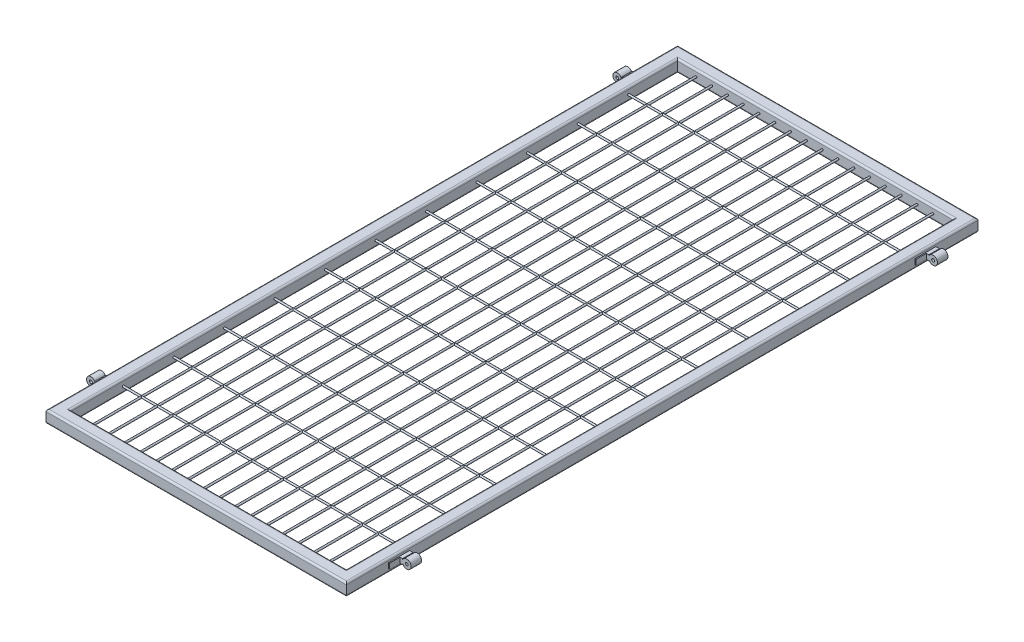
from build123d import *

# Parameters (mm, degrees)
SKETCH_1_W               = 856
SKETCH_1_H               = 1800
SKETCH_1_W_2             = 786
SKETCH_1_H_2             = 1730
EXTRUDE_1_DEPTH          = 35
EXTRUDE_2_DEPTH          = 7.5
SKETCH_3_R               = 12.5
EXTRUDE_3_DEPTH          = 30
SKETCH_4_R               = 4
CUT_EXTRUDE_1_DEPTH      = 30
PATTERN_LINEAR_1_COUNT   = 2
PATTERN_LINEAR_1_PITCH   = 1500
FILLET_1_R               = 5
MIRROR_1_COPY_1_DEPTH    = 7.5
MIRROR_1_COPY_2_SKETCH_R = 12.5
MIRROR_1_COPY_2_DEPTH    = 30
MIRROR_1_COPY_3_SKETCH_R = 4
MIRROR_1_COPY_3_DEPTH    = 30
SKETCH_5_R               = 2.5
EXTRUDE_4_DEPTH          = 786
PATTERN_LINEAR_2_COUNT   = 11
PATTERN_LINEAR_2_PITCH   = 144
EXTRUDE_5_REACH          = 1826.926
SKETCH_6_R               = 2.5
PATTERN_LINEAR_3_COUNT   = 16
PATTERN_LINEAR_3_PITCH   = 45


with BuildPart() as part:
    # 草图1 → 凸台-拉伸1 (new body)
    with BuildSketch(Plane(origin=(0, 0, 0), x_dir=(1, 0, 0), z_dir=(0, 1, 0))):
        Rectangle(SKETCH_1_W, SKETCH_1_H)
        Rectangle(SKETCH_1_W_2, SKETCH_1_H_2, mode=Mode.SUBTRACT)
    extrude(amount=EXTRUDE_1_DEPTH)

    # 草图2 → 凸台-拉伸2 (add, symmetric)
    with BuildSketch(Plane(origin=(0, 17.5, 0), x_dir=(1, 0, 0), z_dir=(0, 1, 0))):
        Polygon((-428, 780), (-428, 720), (-431, 720), (-431, 750), (-438, 750), (-438, 780), align=None)
    extrude_2 = extrude(amount=EXTRUDE_2_DEPTH, both=True)

    # 草图3 → 凸台-拉伸3 (add)
    with BuildSketch(Plane(origin=(0, 0, -780), x_dir=(-1, 0, 0), z_dir=(0, 0, -1))):
        with Locations((450, 17.5)):
            Circle(SKETCH_3_R)
    extrude_3 = extrude(amount=-EXTRUDE_3_DEPTH)

    # 草图4 → 切除-拉伸1 (cut)
    with BuildSketch(Plane.XY.offset(-750)):
        with Locations((-450, 17.5)):
            Circle(SKETCH_4_R)
    cut_extrude_1 = extrude(amount=-CUT_EXTRUDE_1_DEPTH, mode=Mode.SUBTRACT)

    # 阵列(线性)1: 凸台-拉伸2, 凸台-拉伸3, 切除-拉伸1 ×2
    with Locations(*[(0, 0, i * PATTERN_LINEAR_1_PITCH) for i in range(1, PATTERN_LINEAR_1_COUNT)]):
        add(extrude_2)
        add(extrude_3)
        add(cut_extrude_1, mode=Mode.SUBTRACT)

    # 圆角1
    fillet_1_edges = [part.edges().sort_by_distance(p)[0] for p in [
        (428, 35, 0),
        (0, 35, -900),
        (-393, 0, 0),
        (0, 0, 865),
        (393, 0, 0),
        (0, 0, -865),
        (-393, 35, 0),
        (0, 35, 865),
        (393, 35, 0),
        (0, 35, -865),
        (-428, 35, 0),
        (0, 0, -900),
        (428, 0, 0),
        (0, 0, 900),
        (-428, 0, 0),
        (0, 35, 900),
    ]]
    fillet(fillet_1_edges, radius=FILLET_1_R)

    # 镜向1: 凸台-拉伸2, 凸台-拉伸3, 切除-拉伸1 across plane
    add(extrude_2.mirror(Plane.ZY))
    add(extrude_3.mirror(Plane.ZY))
    add(cut_extrude_1.mirror(Plane.ZY), mode=Mode.SUBTRACT)

    # 镜向1 copy 1 sketch → 镜向1 copy 1 (add, symmetric)
    with BuildSketch(Plane(origin=(0, 17.5, 1500), x_dir=(-1, 0, 0), z_dir=(0, 1, 0))):
        Polygon((-428, -780), (-428, -720), (-431, -720), (-431, -750), (-438, -750), (-438, -780), align=None)
    extrude(amount=MIRROR_1_COPY_1_DEPTH, both=True)

    # 镜向1 copy 2 sketch → 镜向1 copy 2 (add)
    with BuildSketch(Plane(origin=(0, 0, 720), x_dir=(1, 0, 0), z_dir=(0, 0, -1))):
        with Locations((450, -17.5)):
            Circle(MIRROR_1_COPY_2_SKETCH_R)
    extrude(amount=-MIRROR_1_COPY_2_DEPTH)

    # 镜向1 copy 3 sketch → 镜向1 copy 3 (cut)
    with BuildSketch(Plane(origin=(0, 0, 750), x_dir=(-1, 0, 0), z_dir=(0, 0, 1))):
        with Locations((-450, -17.5)):
            Circle(MIRROR_1_COPY_3_SKETCH_R)
    extrude(amount=-MIRROR_1_COPY_3_DEPTH, mode=Mode.SUBTRACT)

    # 草图5 → 凸台-拉伸4 (add)
    with BuildSketch(Plane(origin=(-393, 0, 0), x_dir=(0, 0, -1), z_dir=(1, 0, 0))):
        with Locations(Location((725, 17.5, 0), (0, 0, 180))):
            Circle(SKETCH_5_R)
    extrude_4 = extrude(amount=EXTRUDE_4_DEPTH)

    # 阵列(线性)2: 凸台-拉伸4 ×11
    with Locations(*[(0, 0, i * PATTERN_LINEAR_2_PITCH) for i in range(1, PATTERN_LINEAR_2_COUNT)]):
        add(extrude_4)

    # 凸台-拉伸5: up to this face of the body (flat: up to its plane)
    extrude_5_end = Plane(part.part.faces().sort_by_distance((0, 17.5, 865))[0])
    # 草图6 → 凸台-拉伸5 (add, up to the picked face)
    with BuildSketch(Plane.XY.offset(-865), mode=Mode.PRIVATE) as extrude_5_sk1:
        with Locations(Location((-340.5, 17.5, 0), (0, 0, 90))):
            Circle(SKETCH_6_R)
    extrude_5_tool1 = split(extrude(extrude_5_sk1.sketch, amount=EXTRUDE_5_REACH, mode=Mode.PRIVATE), bisect_by=extrude_5_end, keep=Keep.BOTH, mode=Mode.PRIVATE)
    extrude_5 = extrude_5_tool1.solids().sort_by(Axis((-340.5, 17.5, -865), (0, 0, 1)))[0]
    add(extrude_5)

    # 阵列(线性)3: 凸台-拉伸5 ×16
    with Locations(*[(i * PATTERN_LINEAR_3_PITCH, 0, 0) for i in range(1, PATTERN_LINEAR_3_COUNT)]):
        add(extrude_5)


solid = part.part
